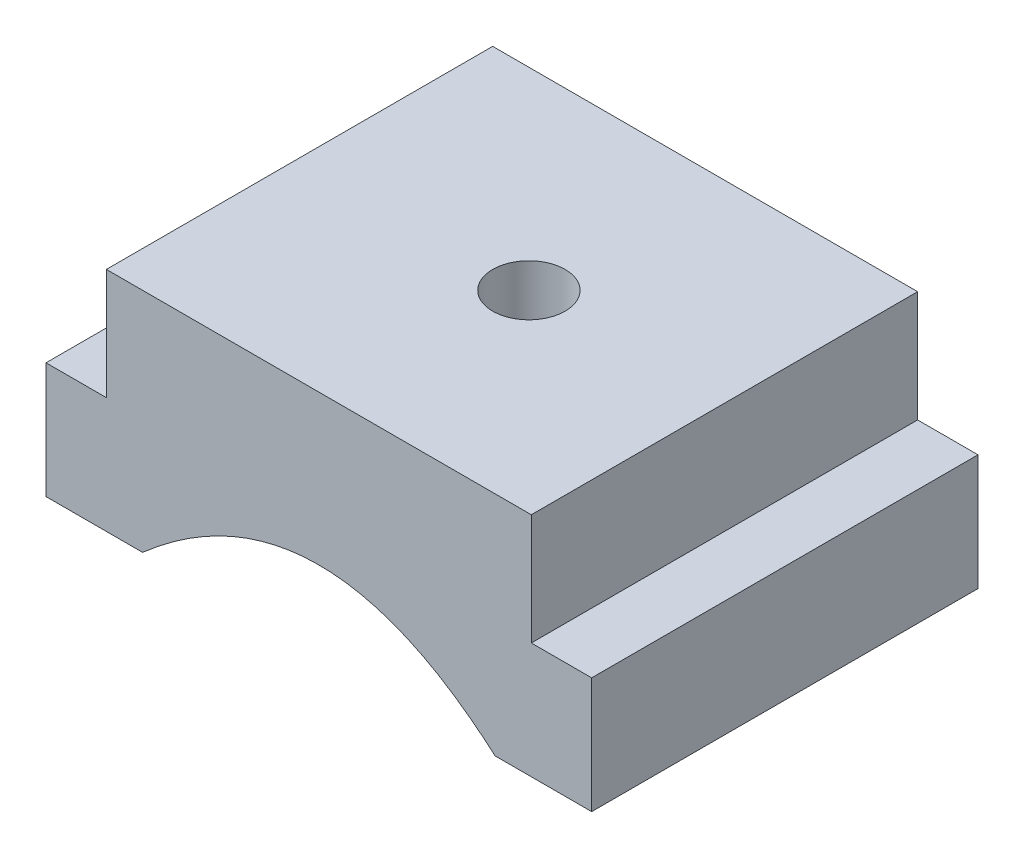
from build123d import *

# Parameters (mm, degrees)
EXTRUDE_1_DEPTH     = 80
SKETCH_4_R          = 7.5
CUT_EXTRUDE_1_DEPTH = 119.184803146


with BuildPart() as part:
    # 草图3 → 凸台-拉伸1 (new body)
    with BuildSketch(Plane.XY):
        with BuildLine():
            Line((60.702784473, 47), (-27.297215527, 47))
            Line((-27.297215527, 47), (-27.297215527, 24))
            Line((-27.297215527, 24), (-39.797215527, 24))
            Line((-39.797215527, 24), (-39.797215527, 0))
            Line((-39.797215527, 0), (-19.797215527, 0))
            add(Edge.make_bspline(
                [(-19.797215527, 0), (16.702784473, 32), (53.202784473, 0)],
                knots=[0, 0, 0, 1, 1, 1], degree=2))
            Line((53.202784473, 0), (73.202784473, 0))
            Line((73.202784473, 0), (73.202784473, 24))
            Line((73.202784473, 24), (60.702784473, 24))
            Line((60.702784473, 24), (60.702784473, 47))
        make_face()
    extrude(amount=EXTRUDE_1_DEPTH)

    # 草图4 → 切除-拉伸1 (cut, through all)
    with BuildSketch(Plane(origin=(0, 47, 0), x_dir=(1, 0, 0), z_dir=(0, 1, 0))):
        with Locations(Location((20.202784473, -40, 0), (0, 0, 180))):
            Circle(SKETCH_4_R)
    extrude(amount=-CUT_EXTRUDE_1_DEPTH, mode=Mode.SUBTRACT)


solid = part.part
